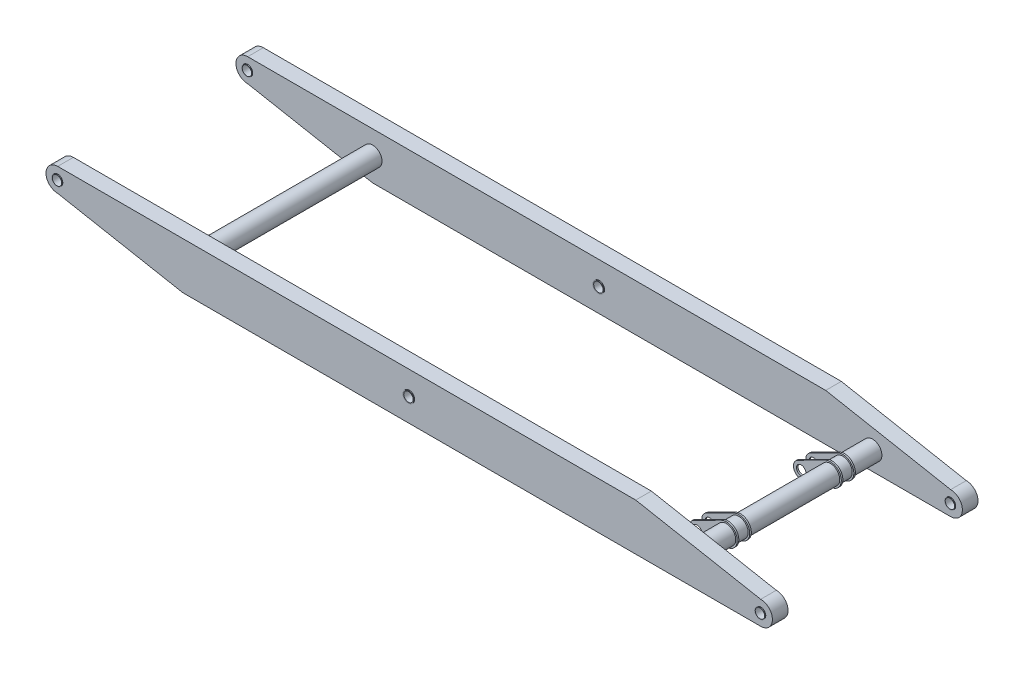
from build123d import *

# Parameters (mm, degrees)
EXTRUDE_1_DEPTH          = 100
SKETCH_2_R               = 30
CUT_EXTRUDE_1_DEPTH      = 100
SKETCH_3_R               = 32.5
SKETCH_3_R_2             = 30
EXTRUDE_2_DEPTH          = 5
EXTRUDE_START            = 5
SKETCH_4_R               = 32.5
SKETCH_4_R_2             = 30
EXTRUDE_3_DEPTH          = 5
SKETCH_5_R               = 30
CUT_EXTRUDE_2_DEPTH      = 248
SKETCH_6_R               = 35
SKETCH_6_R_2             = 30
EXTRUDE_4_DEPTH          = 5
SKETCH_7_R               = 35
SKETCH_7_R_2             = 30
EXTRUDE_5_DEPTH          = 5
SKETCH_8_R               = 60
EXTRUDE_6_DEPTH          = 558
SKETCH_9_R               = 60
EXTRUDE_7_DEPTH          = 1116
SKETCH_12_R              = 30
EXTRUDE_9_DEPTH          = 10
PATTERN_LINEAR_2_COUNT   = 2
PATTERN_LINEAR_2_PITCH   = 80
MIRROR_3_COPY_1_SKETCH_R = 30
MIRROR_3_COPY_1_DEPTH    = 10
SCALE1_SCALE             = 0.345


with BuildPart() as part:
    # 草图1 → 凸台-拉伸1 (new body)
    with BuildSketch(Plane.XY):
        with BuildLine():
            Line((-60.1323511, -127.533248731), (739.8676489, -277.533248731))
            Line((739.8676489, -277.533248731), (4439.8676489, -277.533248731))
            ThreePointArc((4439.8676489, -277.533248731), (4514.8676489, -202.533248731), (4439.8676489, -127.533248731))
            Line((4439.8676489, -127.533248731), (3639.8676489, 22.466751269))
            Line((3639.8676489, 22.466751269), (-60.1323511, 22.466751269))
            ThreePointArc((-60.1323511, 22.466751269), (-135.1323511, -52.533248731), (-60.1323511, -127.533248731))
        make_face()
    extrude(amount=EXTRUDE_1_DEPTH)

    # 草图2 → 切除-拉伸1 (cut)
    with BuildSketch(Plane.XY.offset(100)):
        with Locations((-60.1323511, -52.533248731)):
            Circle(SKETCH_2_R)
        with Locations((4439.8676489, -202.533248731)):
            Circle(SKETCH_2_R)
    extrude(amount=-CUT_EXTRUDE_1_DEPTH, mode=Mode.SUBTRACT)

    # 草图3 → 凸台-拉伸2 (add)
    # profile 1 of 2: a face of its own
    with BuildSketch(Plane(origin=(0, 0, 0), x_dir=(-1, 0, 0), z_dir=(0, 0, -1))):
        with Locations(Location((-4439.8676489, -202.533248731, 0), (0, 0, 180))):
            Circle(SKETCH_3_R)
        with Locations(Location((-4439.8676489, -202.533248731, 0), (0, 0, 180))):
            Circle(SKETCH_3_R_2, mode=Mode.SUBTRACT)
    # profile 2 of 2: a face of its own
    with BuildSketch(Plane(origin=(0, 0, 0), x_dir=(-1, 0, 0), z_dir=(0, 0, -1))):
        with Locations(Location((60.1323511, -52.533248731, 0), (0, 0, 180))):
            Circle(SKETCH_3_R)
        with Locations(Location((60.1323511, -52.533248731, 0), (0, 0, 180))):
            Circle(SKETCH_3_R_2, mode=Mode.SUBTRACT)
    extrude(amount=EXTRUDE_2_DEPTH)

    # 草图4 → 凸台-拉伸3 (add)
    # profile 1 of 2: a face of its own
    with BuildSketch(Plane.XY.offset(100).offset(EXTRUDE_START)):
        with Locations((-60.1323511, -52.533248731)):
            Circle(SKETCH_4_R)
        with Locations((-60.1323511, -52.533248731)):
            Circle(SKETCH_4_R_2, mode=Mode.SUBTRACT)
    # profile 2 of 2: a face of its own
    with BuildSketch(Plane.XY.offset(100).offset(EXTRUDE_START)):
        with Locations((4439.8676489, -202.533248731)):
            Circle(SKETCH_4_R)
        with Locations((4439.8676489, -202.533248731)):
            Circle(SKETCH_4_R_2, mode=Mode.SUBTRACT)
    extrude(amount=-EXTRUDE_3_DEPTH)

    # 草图5 → 切除-拉伸2 (cut)
    with BuildSketch(Plane(origin=(0, 0, 0), x_dir=(-1, 0, 0), z_dir=(0, 0, -1))):
        with Locations((-2189.8676489, -127.533248731)):
            Circle(SKETCH_5_R)
    extrude(amount=-CUT_EXTRUDE_2_DEPTH, mode=Mode.SUBTRACT)

    # 草图6 → 凸台-拉伸4 (add)
    with BuildSketch(Plane(origin=(0, 0, 0), x_dir=(-1, 0, 0), z_dir=(0, 0, -1)).offset(EXTRUDE_START)):
        with Locations(Location((-2189.8676489, -127.533248731, 0), (0, 0, 180))):
            Circle(SKETCH_6_R)
        with Locations((-2189.8676489, -127.533248731)):
            Circle(SKETCH_6_R_2, mode=Mode.SUBTRACT)
    extrude(amount=-EXTRUDE_4_DEPTH)

    # 草图7 → 凸台-拉伸5 (add)
    with BuildSketch(Plane.XY.offset(100)):
        with Locations((2189.8676489, -127.533248731)):
            Circle(SKETCH_7_R)
        with Locations(Location((2189.8676489, -127.533248731, 0), (0, 0, 180))):
            Circle(SKETCH_7_R_2, mode=Mode.SUBTRACT)
    extrude(amount=EXTRUDE_5_DEPTH)

    # 草图8 → 凸台-拉伸6 (add)
    with BuildSketch(Plane.XY.offset(100)):
        with Locations((739.8676489, -127.533248731)):
            Circle(SKETCH_8_R)
    extrude(amount=EXTRUDE_6_DEPTH)

    # 镜向1: part across plane


with BuildPart() as part_1:
    add(part.part)
    add(part.part.mirror(Plane(origin=(739.8676489, -127.533248731, 658), x_dir=(1, 0, 0), z_dir=(0, 0, 1))))

    # 草图9 → 凸台-拉伸7 (add)
    with BuildSketch(Plane(origin=(0, 0, 1216), x_dir=(-1, 0, 0), z_dir=(0, 0, -1))):
        with Locations(Location((-3939.8676489, -157.533248731, 0), (0, 0, 180))):
            Circle(SKETCH_9_R)
    extrude(amount=EXTRUDE_7_DEPTH)

    # 草图12 → 凸台-拉伸9 (add)
    with BuildSketch(Plane(origin=(0, 0, 370), x_dir=(-1, 0, 0), z_dir=(0, 0, -1))):
        with BuildLine():
            Line((-3730.655081085, -184.553638593), (-3908.372573379, -95.018768665))
            ThreePointArc((-3908.372573379, -95.018768665), (-4005.218278755, -132.447492263), (-3958.292598451, -225.06488009))
            Line((-3958.292598451, -225.06488009), (-3766.312241851, -277.443718182))
            ThreePointArc((-3766.312241851, -277.443718182), (-3706.472542276, -247.125236117), (-3730.655081085, -184.553638593))
        make_face()
        with Locations((-3753.151563601, -229.20683864)):
            Circle(SKETCH_12_R, mode=Mode.SUBTRACT)
    extrude_9 = extrude(amount=EXTRUDE_9_DEPTH)

    # 阵列(线性)2: 凸台-拉伸9 ×2
    with Locations(*[(0, 0, -i * PATTERN_LINEAR_2_PITCH) for i in range(1, PATTERN_LINEAR_2_COUNT)]):
        add(extrude_9)

    # 镜向3: 凸台-拉伸9 across plane
    add(extrude_9.mirror(Plane(origin=(0, 0, 658), x_dir=(1, 0, 0), z_dir=(0, 0, -1))))

    # 镜向3 copy 1 sketch → 镜向3 copy 1 (add)
    with BuildSketch(Plane(origin=(0, 0, 1026), x_dir=(-1, 0, 0), z_dir=(0, 0, 1))):
        with BuildLine():
            Line((-3730.655081085, 184.553638593), (-3908.372573379, 95.018768665))
            ThreePointArc((-3908.372573379, 95.018768665), (-4005.218278755, 132.447492263), (-3958.292598451, 225.06488009))
            Line((-3958.292598451, 225.06488009), (-3766.312241851, 277.443718182))
            ThreePointArc((-3766.312241851, 277.443718182), (-3706.472542276, 247.125236117), (-3730.655081085, 184.553638593))
        make_face()
        with Locations((-3753.151563601, 229.20683864)):
            Circle(MIRROR_3_COPY_1_SKETCH_R, mode=Mode.SUBTRACT)
    extrude(amount=MIRROR_3_COPY_1_DEPTH)


with BuildPart() as part_2:
    # Scale1: scaled about (2208.887322041, -129.132987592, 658)
    add(part_1.part.scale(SCALE1_SCALE).moved(Location((1446.821195937, -84.582106873, 430.99))))


solid = part_2.part
